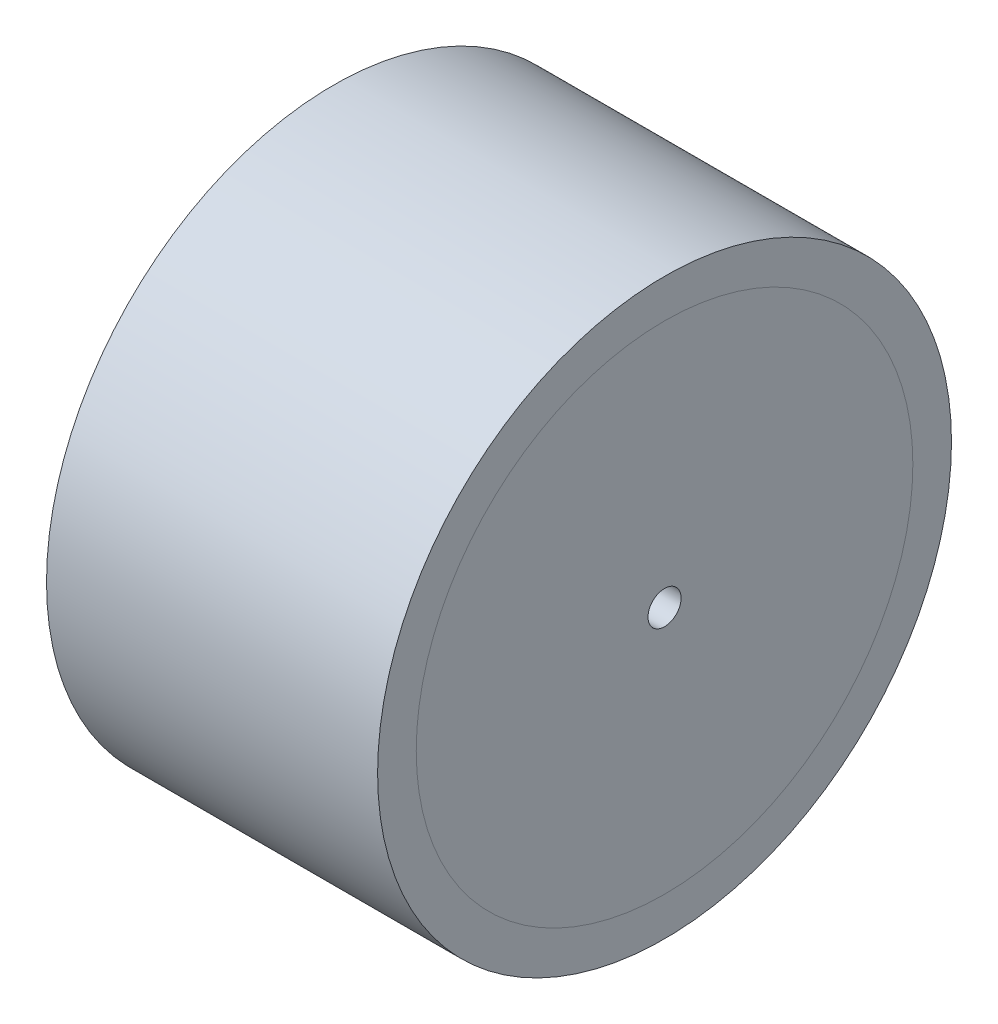
from build123d import *

# Parameters (mm, degrees)
SKETCH1_R           = 26
BOSS_EXTRUDE1_DEPTH = 30
SKETCH2_R           = 1.5
CUT_EXTRUDE1_DEPTH  = 48.455242071


with BuildPart() as part:
    # Sketch1 → Boss-Extrude1 (new body)
    with BuildSketch(Plane(origin=(0, 0, 0), x_dir=(0, 0, -1), z_dir=(1, 0, 0))):
        Circle(SKETCH1_R)
    extrude(amount=BOSS_EXTRUDE1_DEPTH)

    # Sketch2 → Cut-Extrude1 (cut, through all)
    with BuildSketch(Plane.ZY):
        Circle(SKETCH2_R)
    extrude(amount=-CUT_EXTRUDE1_DEPTH, mode=Mode.SUBTRACT)


solid = part.part
